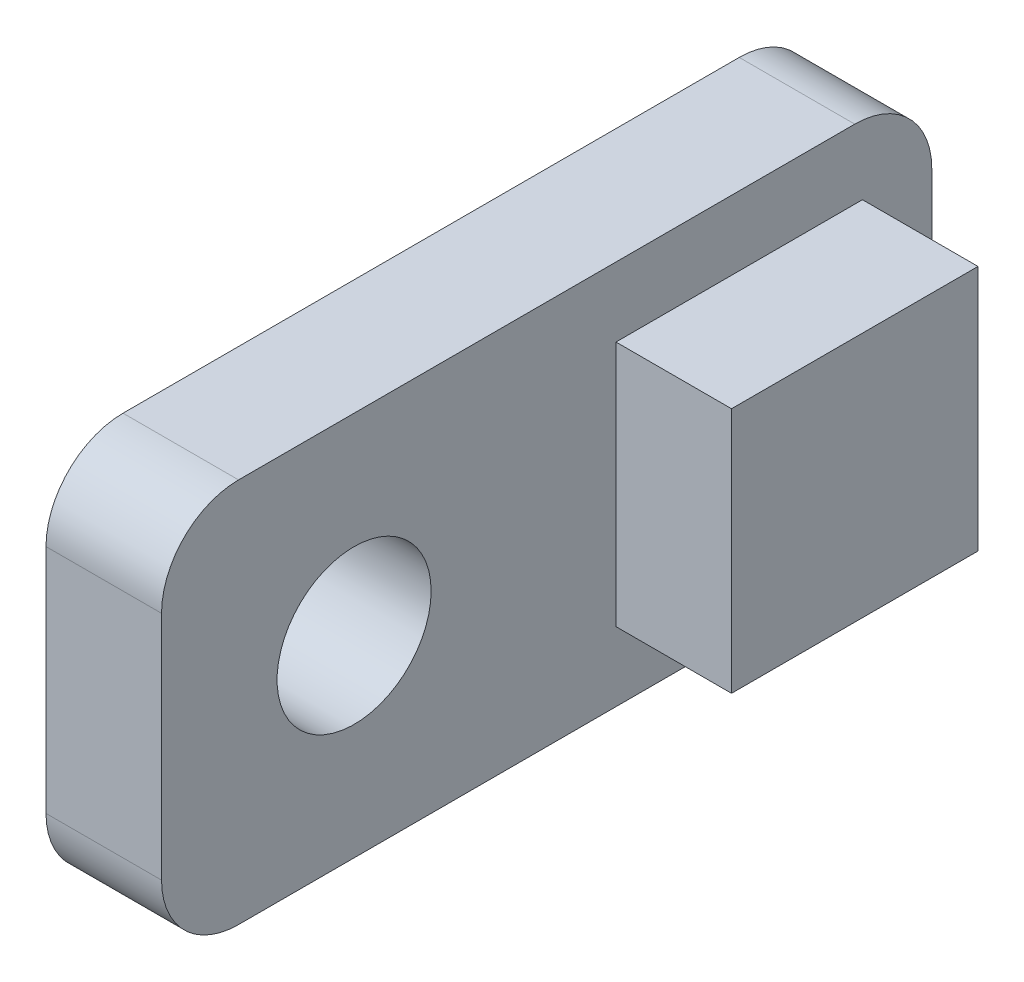
from build123d import *

# Parameters (mm, degrees)
SKETCH1_R           = 2
BOSS_EXTRUDE1_DEPTH = 3
SKETCH1_3_W         = 6.4
SKETCH1_3_H         = 6.4
BOSS_EXTRUDE2_DEPTH = 6


with BuildPart() as part:
    # Sketch1 → Boss-Extrude1 (new body)
    with BuildSketch(Plane(origin=(0, 0, 0), x_dir=(0, 0, -1), z_dir=(1, 0, 0))):
        with BuildLine():
            Line((-8, -5), (8, -5))
            ThreePointArc((8, -5), (9.414213562, -4.414213562), (10, -3))
            Line((10, -3), (10, 3))
            ThreePointArc((10, 3), (9.414213562, 4.414213562), (8, 5))
            Line((8, 5), (-8, 5))
            ThreePointArc((-8, 5), (-9.414213562, 4.414213562), (-10, 3))
            Line((-10, 3), (-10, -3))
            ThreePointArc((-10, -3), (-9.414213562, -4.414213562), (-8, -5))
        make_face()
        with Locations((-5, 0)):
            Circle(SKETCH1_R, mode=Mode.SUBTRACT)
    extrude(amount=BOSS_EXTRUDE1_DEPTH)

    # Sketch1<3> → Boss-Extrude2 (add)
    with BuildSketch(Plane(origin=(0, 0, 0), x_dir=(0, 0, -1), z_dir=(1, 0, 0))):
        with Locations((5, 0)):
            Rectangle(SKETCH1_3_W, SKETCH1_3_H)
    extrude(amount=BOSS_EXTRUDE2_DEPTH)


solid = part.part
